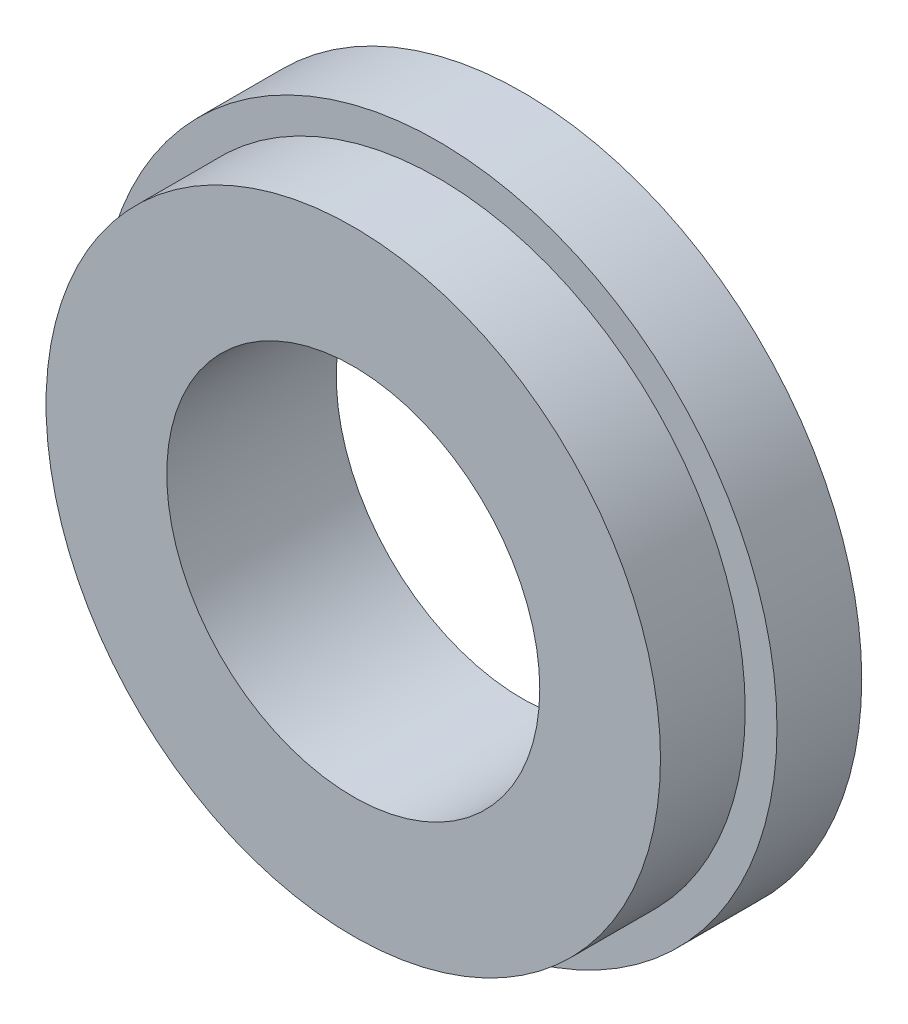
from build123d import *

# Parameters (mm, degrees)
SKETCH1_W = 12.7
SKETCH1_H = 18.088872006


with BuildPart() as part:
    # Sketch1 → Revolve1 (revolve)
    with BuildSketch(Plane(origin=(0, 0, 0), x_dir=(0, 0, -1), z_dir=(1, 0, 0)), mode=Mode.PRIVATE) as revolve1_sk:
        Polygon((12.7, 27.948627994), (25.4, 27.948627994), (25.4, 50.8), (12.7, 50.8), (12.7, 46.0375), align=None)
        with Locations((6.35, 36.993063997)):
            Rectangle(SKETCH1_W, SKETCH1_H)
    revolve(revolve1_sk.sketch.rotate(Axis((0, 0, 0), (0, 0, -1)), 90), axis=Axis((0, 0, 0), (0, 0, -1)))


solid = part.part
